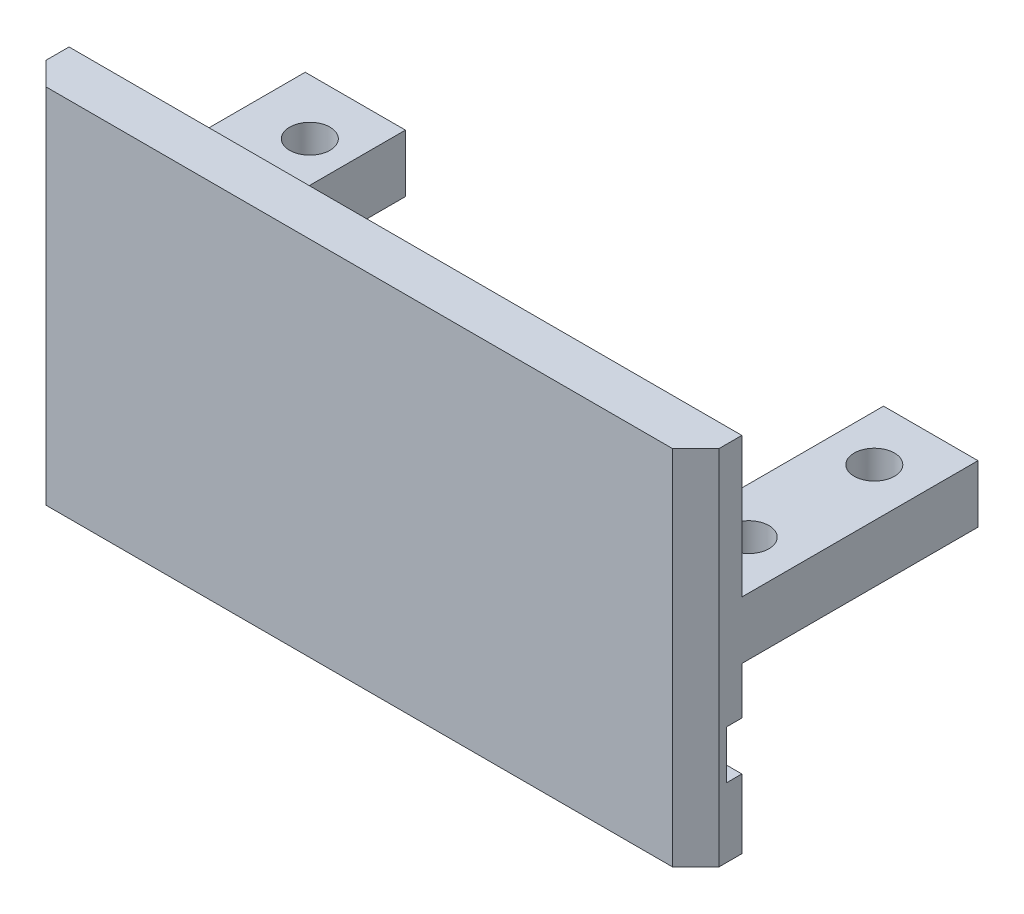
from build123d import *

# Parameters (mm, degrees)
SZKIC1_W                    = 58.4
SZKIC1_H                    = 31.45
DODANIE_WYCI_GNI_CIE1_DEPTH = 4
SZKIC2_W                    = 8.2
SZKIC2_H                    = 5
SZKIC2_W_2                  = 8.7
DODANIE_WYCI_GNI_CIE2_DEPTH = 20.5
WYTNIJ_WYCI_GNI_CIE1_REACH  = 42.563
SZKIC3_R                    = 1.75
SZKIC5_W                    = 58.4
SZKIC5_H                    = 4.2
WYTNIJ_WYCI_GNI_CIE2_DEPTH  = 1.35
SFAZOWANIE1_SIZE            = 2


with BuildPart() as part:
    # Szkic1 → Dodanie-wyciągnięcie1 (new body)
    with BuildSketch(Plane.XY):
        Rectangle(SZKIC1_W, SZKIC1_H)
    extrude(amount=DODANIE_WYCI_GNI_CIE1_DEPTH)

    # Szkic2 → Dodanie-wyciągnięcie2 (add)
    with BuildSketch(Plane(origin=(0, 0, 0), x_dir=(-1, 0, 0), z_dir=(0, 0, -1))):
        with Locations((-25.1, 1.075)):
            Rectangle(SZKIC2_W, SZKIC2_H)
        with Locations((24.85, 1.075)):
            Rectangle(SZKIC2_W_2, SZKIC2_H)
    extrude(amount=DODANIE_WYCI_GNI_CIE2_DEPTH)

    # Szkic3 → Wytnij-wyciągnięcie1 (cut, up to next)
    with BuildSketch(Plane(origin=(0, 3.575, 0), x_dir=(1, 0, 0), z_dir=(0, 1, 0)), mode=Mode.PRIVATE) as wytnij_wyci_gni_cie1_sk1:
        with Locations(Location((25, 4.8, 0), (0, 0, 180))):
            Circle(SZKIC3_R)
    wytnij_wyci_gni_cie1_tool1 = extrude(wytnij_wyci_gni_cie1_sk1.sketch, amount=-WYTNIJ_WYCI_GNI_CIE1_REACH, mode=Mode.PRIVATE) & part.part
    # Szkic3 → Wytnij-wyciągnięcie1 (cut, up to next)
    with BuildSketch(Plane(origin=(0, 3.575, 0), x_dir=(1, 0, 0), z_dir=(0, 1, 0)), mode=Mode.PRIVATE) as wytnij_wyci_gni_cie1_sk2:
        with Locations(Location((-24, 4.8, 0), (0, 0, 180))):
            Circle(SZKIC3_R)
    wytnij_wyci_gni_cie1_tool2 = extrude(wytnij_wyci_gni_cie1_sk2.sketch, amount=-WYTNIJ_WYCI_GNI_CIE1_REACH, mode=Mode.PRIVATE) & part.part
    # Szkic3 → Wytnij-wyciągnięcie1 (cut, up to next)
    with BuildSketch(Plane(origin=(0, 3.575, 0), x_dir=(1, 0, 0), z_dir=(0, 1, 0)), mode=Mode.PRIVATE) as wytnij_wyci_gni_cie1_sk3:
        with Locations(Location((25, 15.7, 0), (0, 0, 270))):
            Circle(SZKIC3_R)
    wytnij_wyci_gni_cie1_tool3 = extrude(wytnij_wyci_gni_cie1_sk3.sketch, amount=-WYTNIJ_WYCI_GNI_CIE1_REACH, mode=Mode.PRIVATE) & part.part
    # Szkic3 → Wytnij-wyciągnięcie1 (cut, up to next)
    with BuildSketch(Plane(origin=(0, 3.575, 0), x_dir=(1, 0, 0), z_dir=(0, 1, 0)), mode=Mode.PRIVATE) as wytnij_wyci_gni_cie1_sk4:
        with Locations(Location((-24, 15.7, 0), (0, 0, 180))):
            Circle(SZKIC3_R)
    wytnij_wyci_gni_cie1_tool4 = extrude(wytnij_wyci_gni_cie1_sk4.sketch, amount=-WYTNIJ_WYCI_GNI_CIE1_REACH, mode=Mode.PRIVATE) & part.part
    add(wytnij_wyci_gni_cie1_tool1.solids().sort_by_distance((25, 3.575, -4.8))[0], mode=Mode.SUBTRACT)
    add(wytnij_wyci_gni_cie1_tool2.solids().sort_by_distance((-24, 3.575, -4.8))[0], mode=Mode.SUBTRACT)
    add(wytnij_wyci_gni_cie1_tool3.solids().sort_by_distance((25, 3.575, -15.7))[0], mode=Mode.SUBTRACT)
    add(wytnij_wyci_gni_cie1_tool4.solids().sort_by_distance((-24, 3.575, -15.7))[0], mode=Mode.SUBTRACT)

    # Szkic5 → Wytnij-wyciągnięcie2 (cut)
    with BuildSketch(Plane(origin=(0, 0, 0), x_dir=(-1, 0, 0), z_dir=(0, 0, -1))):
        with Locations((0, -7.625)):
            Rectangle(SZKIC5_W, SZKIC5_H)
    extrude(amount=-WYTNIJ_WYCI_GNI_CIE2_DEPTH, mode=Mode.SUBTRACT)

    # Sfazowanie1
    sfazowanie1_edges = [part.edges().sort_by_distance(p)[0] for p in [
        (-29.2, 0, 4),
        (29.2, 0, 4),
    ]]
    chamfer(sfazowanie1_edges, length=SFAZOWANIE1_SIZE)


solid = part.part
